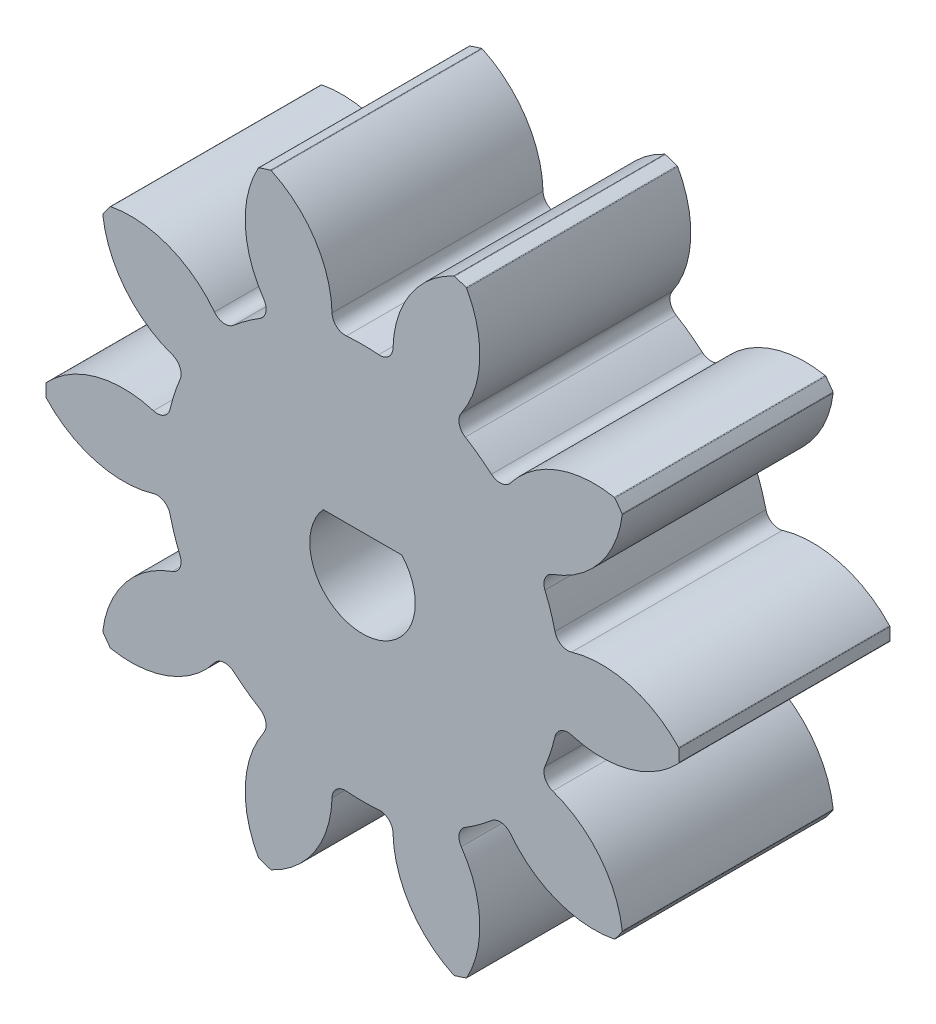
from build123d import *

# Parameters (mm, degrees)
ESBO_O1_W                    = 18
ESBO_O1_H                    = 12
CORTE_EXTRUS_O1_DEPTH        = 29.142494559
FILETE3_R                    = 0.06
FILETE4_R                    = 0.751
PADR_OCIRCULAR1_COUNT        = 10
FILETE3_OF_PADR_OCIRCULAR1_R = 0.06
FILETE4_OF_PADR_OCIRCULAR1_R = 0.751
CORTE_EXTRUS_O2_DEPTH        = 28.653911494


with BuildPart() as part:
    # Esboço1 → Revolução1 (revolve)
    with BuildSketch(Plane(origin=(0, 0, 0), x_dir=(1, 0, 0), z_dir=(0, 1, 0)), mode=Mode.PRIVATE) as revolu_o1_sk:
        with Locations((9, 6)):
            Rectangle(ESBO_O1_W, ESBO_O1_H)
    revolve(revolu_o1_sk.sketch.rotate(Axis((0, 0, 0), (0, 0, 1)), 180), axis=Axis((0, 0, 0), (0, 0, 1)))

    # Esboço2 → Corte-extrusão1 (cut, through all)
    with BuildSketch(Plane.XY):
        with BuildLine():
            ThreePointArc((1.768949054, 11.109042274), (0, 11.249), (-1.768949054, 11.109042274))
            ThreePointArc((-1.768949054, 11.109042274), (-2.508977513, 14.741789417), (-5.242576524, 17.246171649))
            ThreePointArc((-5.242576524, 17.246171649), (0, 18.0254), (5.242576524, 17.246171649))
            ThreePointArc((5.242576524, 17.246171649), (2.508977513, 14.741789417), (1.768949054, 11.109042274))
        make_face()
    corte_extrus_o1 = extrude(amount=-CORTE_EXTRUS_O1_DEPTH, mode=Mode.SUBTRACT)

    # Filete3
    filete3_edges = [part.edges().sort_by_distance(p)[0] for p in [
        (5.207776208, 17.230178959, -6),
        (-5.207776208, 17.230178959, -6),
    ]]
    fillet(filete3_edges, radius=FILETE3_R)

    # Filete4
    filete4_edges = [part.edges().sort_by_distance(p)[0] for p in [
        (-1.768949054, 11.109042274, -6),
        (1.768949054, 11.109042274, -6),
    ]]
    fillet(filete4_edges, radius=FILETE4_R)

    # PadrãoCircular1: Corte-extrusão1 ×10 about axis
    padr_ocircular1_axis = Axis((0, 0, 0), (0, 0, 1))
    for i in range(1, PADR_OCIRCULAR1_COUNT):
        add(corte_extrus_o1.rotate(padr_ocircular1_axis, i * 360 / PADR_OCIRCULAR1_COUNT), mode=Mode.SUBTRACT)

    # Filete3 of PadrãoCircular1
    filete3_of_padr_ocircular1_edges = [part.edges().sort_by_distance(p)[0] for p in [
        (-5.914465631, 17.000561647, -6),
        (-14.340824542, 10.878453542, -6),
        (-14.777582625, 10.277307613, -6),
        (-17.996165327, 0.371528616, -6),
        (-17.996165327, -0.371528616, -6),
        (-14.777582625, -10.277307613, -6),
        (-14.340824542, -10.878453542, -6),
        (-5.914465631, -17.000561647, -6),
        (-5.207776208, -17.230178959, -6),
        (5.207776208, -17.230178959, -6),
        (5.914465631, -17.000561647, -6),
        (14.340824542, -10.878453542, -6),
        (14.777582625, -10.277307613, -6),
        (17.996165327, -0.371528616, -6),
        (17.996165327, 0.371528616, -6),
        (14.777582625, 10.277307613, -6),
        (14.340824542, 10.878453542, -6),
        (5.914465631, 17.000561647, -6),
    ]]
    fillet(filete3_of_padr_ocircular1_edges, radius=FILETE3_OF_PADR_OCIRCULAR1_R)

    # Filete4 of PadrãoCircular1
    filete4_of_padr_ocircular1_edges = [part.edges().sort_by_distance(p)[0] for p in [
        (-7.960841063, 7.947641825, -6),
        (-5.098621369, 10.027166157, -6),
        (-11.111962364, 1.750512329, -6),
        (-10.018691724, 5.115253379, -6),
        (-10.018691724, -5.115253379, -6),
        (-11.111962364, -1.750512329, -6),
        (-5.098621369, -10.027166157, -6),
        (-7.960841063, -7.947641825, -6),
        (1.768949054, -11.109042274, -6),
        (-1.768949054, -11.109042274, -6),
        (7.960841063, -7.947641825, -6),
        (5.098621369, -10.027166157, -6),
        (11.111962364, -1.750512329, -6),
        (10.018691724, -5.115253379, -6),
        (10.018691724, 5.115253379, -6),
        (11.111962364, 1.750512329, -6),
        (5.098621369, 10.027166157, -6),
        (7.960841063, 7.947641825, -6),
    ]]
    fillet(filete4_of_padr_ocircular1_edges, radius=FILETE4_OF_PADR_OCIRCULAR1_R)

    # Esboço3 → Corte-extrusão2 (cut, through all)
    with BuildSketch(Plane(origin=(0, 0, -12), x_dir=(-1, 0, 0), z_dir=(0, 0, -1))):
        with BuildLine():
            Line((-2.236067977, 2), (2.236067977, 2))
            ThreePointArc((2.236067977, 2), (0, -3), (-2.236067977, 2))
        make_face()
    extrude(amount=-CORTE_EXTRUS_O2_DEPTH, mode=Mode.SUBTRACT)


solid = part.part
